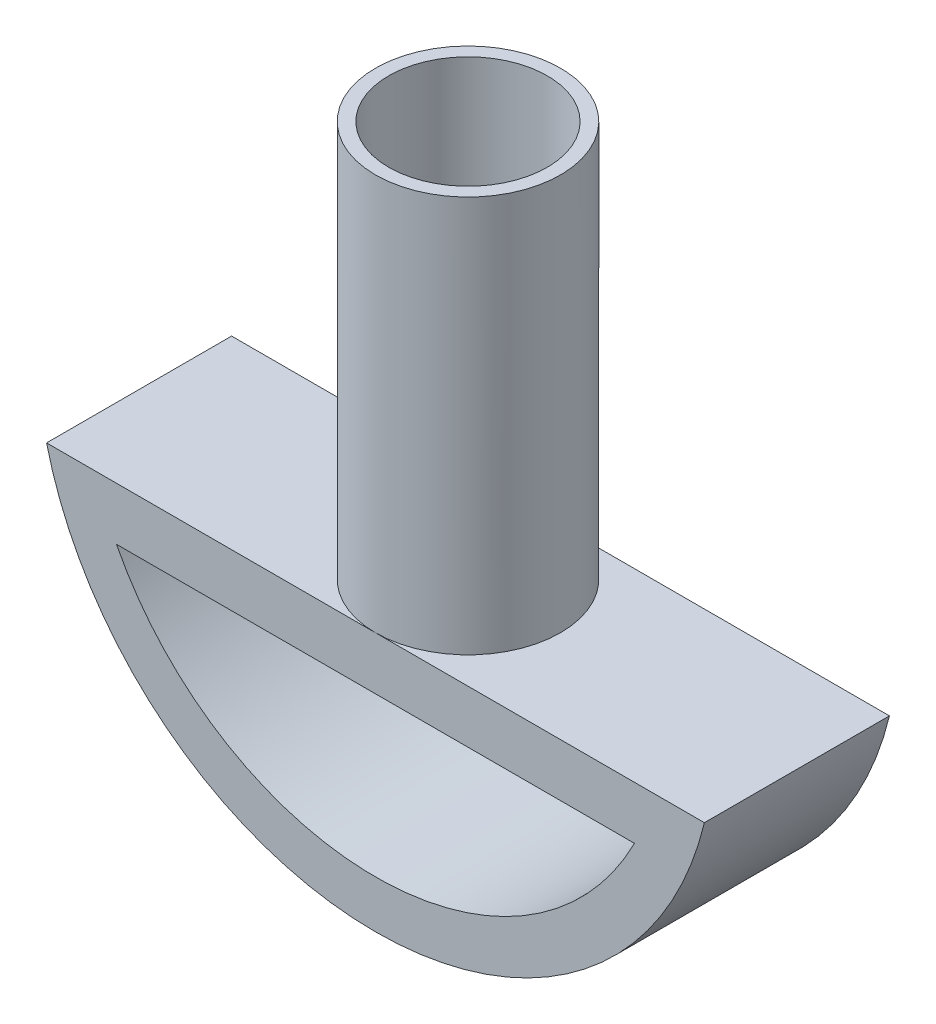
from build123d import *

# Parameters (mm, degrees)
Y_KSEKLIK_EKSTR_ZYON1_DEPTH = 35
KES_EKSTR_ZYON1_DEPTH       = 35
IZIM3_R                     = 17.5
IZIM3_R_2                   = 15
Y_KSEKLIK_EKSTR_ZYON2_DEPTH = 75
IZIM4_R                     = 7.5
KES_EKSTR_ZYON2_DEPTH       = 28


with BuildPart() as part:
    # Çizim1 → Yükseklik-Ekstrüzyon1 (new body)
    with BuildSketch(Plane.XY):
        with BuildLine():
            Line((-62.217360921, -15), (62.217360921, -15))
            ThreePointArc((62.217360921, -15), (0, -64), (-62.217360921, -15))
        make_face()
    extrude(amount=Y_KSEKLIK_EKSTR_ZYON1_DEPTH)

    # Çizim2 → Kes-Ekstrüzyon1 (cut)
    with BuildSketch(Plane.XY.offset(35)):
        with BuildLine():
            Line((-48.989794856, -25), (48.989794856, -25))
            ThreePointArc((48.989794856, -25), (0, -55), (-48.989794856, -25))
        make_face()
    extrude(amount=-KES_EKSTR_ZYON1_DEPTH, mode=Mode.SUBTRACT)

    # Çizim3 → Yükseklik-Ekstrüzyon2 (add)
    with BuildSketch(Plane(origin=(0, -15, 0), x_dir=(1, 0, 0), z_dir=(0, 1, 0))):
        with Locations(Location((0, -17.5, 0), (0, 0, 270))):
            Circle(IZIM3_R)
        with Locations(Location((0, -17.5, 0), (0, 0, 270))):
            Circle(IZIM3_R_2, mode=Mode.SUBTRACT)
    extrude(amount=Y_KSEKLIK_EKSTR_ZYON2_DEPTH)

    # Çizim4 → Kes-Ekstrüzyon2 (cut)
    with BuildSketch(Plane(origin=(0, -15, 0), x_dir=(1, 0, 0), z_dir=(0, 1, 0))):
        with Locations(Location((0, -17.5, 0), (0, 0, 270))):
            Circle(IZIM4_R)
    extrude(amount=-KES_EKSTR_ZYON2_DEPTH, mode=Mode.SUBTRACT)


solid = part.part
